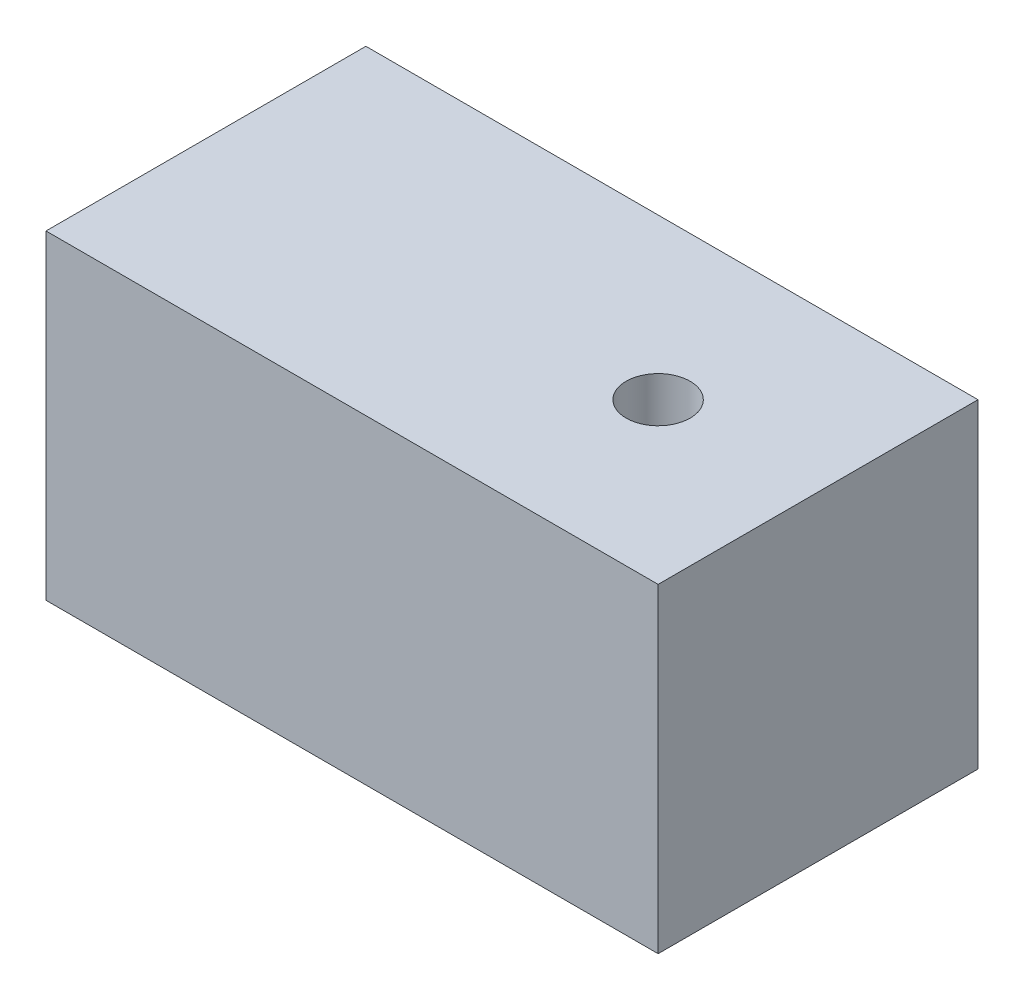
from build123d import *

# Parameters (mm, degrees)
SKETCH1_W           = 24.303155339
SKETCH1_H           = 12.7
BOSS_EXTRUDE1_DEPTH = 12.7
SKETCH2_R           = 1.75
CUT_EXTRUDE1_DEPTH  = 14.224
SKETCH3_R           = 1.27
CUT_EXTRUDE2_DEPTH  = 31.219585693


with BuildPart() as part:
    # Sketch1 → Boss-Extrude1 (new body)
    with BuildSketch(Plane(origin=(0, 0, 0), x_dir=(1, 0, 0), z_dir=(0, 1, 0))):
        with Locations((12.151577669, 6.35)):
            Rectangle(SKETCH1_W, SKETCH1_H)
    extrude(amount=BOSS_EXTRUDE1_DEPTH)

    # Sketch2 → Cut-Extrude1 (cut)
    with BuildSketch(Plane.ZY):
        with Locations((-6.362201195, 6.35)):
            Circle(SKETCH2_R)
    extrude(amount=-CUT_EXTRUDE1_DEPTH, mode=Mode.SUBTRACT)

    # Sketch3 → Cut-Extrude2 (cut, through all)
    with BuildSketch(Plane(origin=(0, 0, 0), x_dir=(1, 0, 0), z_dir=(0, 1, 0))):
        with Locations(Location((17.953155339, 6.35, 0), (0, 0, 270))):
            Circle(SKETCH3_R)
    extrude(amount=CUT_EXTRUDE2_DEPTH, mode=Mode.SUBTRACT)


solid = part.part
